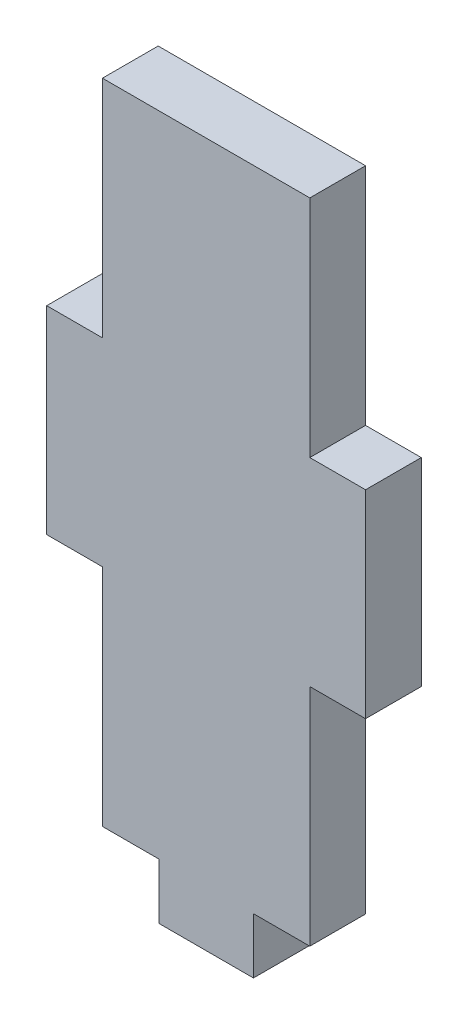
from build123d import *

# Parameters (mm, degrees)
BOSS_EXTRUDE1_DEPTH = 4.3


with BuildPart() as part:
    # Sketch1 → Boss-Extrude1 (new body)
    with BuildSketch(Plane.XY):
        Polygon((8, 7.65), (8, 25), (-8, 25), (-8, 7.65), (-12.3, 7.65), (-12.3, -7.65), (-8, -7.65), (-8, -25), (-3.65, -25), (-3.65, -29.3), (3.65, -29.3), (3.65, -25), (8, -25), (8, -7.65), (12.3, -7.65), (12.3, 7.65), align=None)
    extrude(amount=BOSS_EXTRUDE1_DEPTH)


solid = part.part
